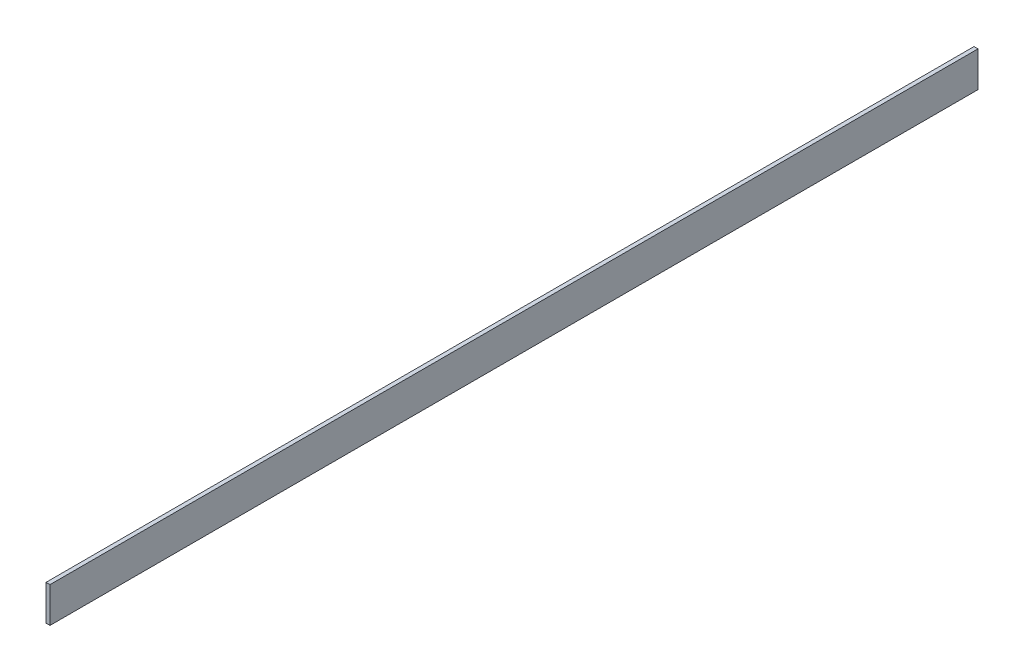
from build123d import *

# Parameters (mm, degrees)
SKETCH_1_W      = 1.8
SKETCH_1_H      = 420
EXTRUDE_1_DEPTH = 8


with BuildPart() as part:
    # 草图1 → 凸台-拉伸1 (new, symmetric)
    with BuildSketch(Plane(origin=(0, 0, 0), x_dir=(1, 0, 0), z_dir=(0, 1, 0))):
        Rectangle(SKETCH_1_W, SKETCH_1_H)
    extrude(amount=EXTRUDE_1_DEPTH, both=True)


solid = part.part
